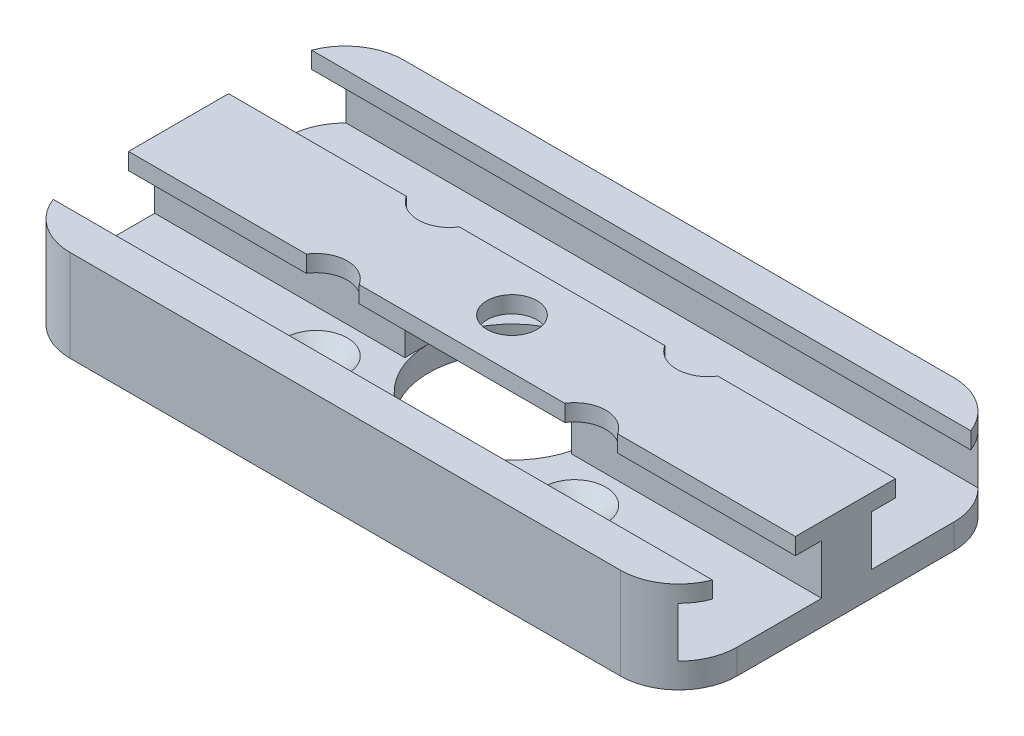
from build123d import *

# Parameters (mm, degrees)
SKETCH1_W                    = 80
SKETCH1_H                    = 40
SKETCH1_R                    = 10
BOSS_EXTRUDE1_DEPTH          = 3
SKETCH2_W                    = 80
SKETCH2_H                    = 4.5
BOSS_EXTRUDE2_DEPTH          = 8
SKETCH3_W                    = 2.5
SKETCH3_H                    = 6
CUT_EXTRUDE1_DEPTH           = 80
SKETCH5_R                    = 1.75
CUT_EXTRUDE3_DEPTH           = 1
SKETCH4_R                    = 3.75
CUT_EXTRUDE4_DEPTH           = 2
CUT_EXTRUDE4_DRAFT           = -45
CUT_EXTRUDE4_PROFILE_2_DEPTH = 2
CUT_EXTRUDE4_PROFILE_2_DRAFT = -45
CUT_EXTRUDE4_PROFILE_3_DEPTH = 2
CUT_EXTRUDE4_PROFILE_3_DRAFT = -45
CUT_EXTRUDE4_PROFILE_4_DEPTH = 2
CUT_EXTRUDE4_PROFILE_4_DRAFT = -45
FILLET1_R                    = 7
SKETCH6_W                    = 30
SKETCH6_H                    = 6
BOSS_EXTRUDE3_DEPTH          = 6
SKETCH7_R                    = 3
BOSS_EXTRUDE4_DEPTH          = 2


with BuildPart() as part:
    # Sketch1 → Boss-Extrude1 (new body)
    with BuildSketch(Plane(origin=(0, 0, 0), x_dir=(1, 0, 0), z_dir=(0, 1, 0))):
        Rectangle(SKETCH1_W, SKETCH1_H)
        with Locations(Location((0, 0, 0), (0, 0, 270))):
            Circle(SKETCH1_R, mode=Mode.SUBTRACT)
    extrude(amount=BOSS_EXTRUDE1_DEPTH)

    # Sketch2 → Boss-Extrude2 (add)
    with BuildSketch(Plane(origin=(0, 3, 0), x_dir=(1, 0, 0), z_dir=(0, 1, 0))):
        with Locations((0, 17.75)):
            Rectangle(SKETCH2_W, SKETCH2_H)
        with Locations((0, -17.75)):
            Rectangle(SKETCH2_W, SKETCH2_H)
    extrude(amount=BOSS_EXTRUDE2_DEPTH)

    # Sketch3 → Cut-Extrude1 (cut)
    with BuildSketch(Plane.ZY.offset(40)):
        with Locations((-16.75, 6)):
            Rectangle(SKETCH3_W, SKETCH3_H)
        with Locations((16.75, 6)):
            Rectangle(SKETCH3_W, SKETCH3_H)
    extrude(amount=-CUT_EXTRUDE1_DEPTH, mode=Mode.SUBTRACT)

    # Sketch5 → Cut-Extrude3 (cut)
    with BuildSketch(Plane.XZ):
        with Locations(Location((-15.5, 8, 0), (0, 0, 270))):
            Circle(SKETCH5_R)
        with Locations(Location((-15.5, -8, 0), (0, 0, 270))):
            Circle(SKETCH5_R)
        with Locations(Location((15.5, 8, 0), (0, 0, 270))):
            Circle(SKETCH5_R)
        with Locations(Location((15.5, -8, 0), (0, 0, 270))):
            Circle(SKETCH5_R)
    extrude(amount=-CUT_EXTRUDE3_DEPTH, mode=Mode.SUBTRACT)


with BuildPart() as cut_extrude4_tool:
    # Sketch4 → Cut-Extrude4 (with draft: the straight prism first)
    with BuildSketch(Plane(origin=(0, 3, 0), x_dir=(1, 0, 0), z_dir=(0, 1, 0))):
        with Locations((-15.5, 8)):
            Circle(SKETCH4_R)
    extrude(amount=-CUT_EXTRUDE4_DEPTH)
    # Cut-Extrude4: the draft: its side faces are tilted about the plane it starts from
    cut_extrude4_sides = [cut_extrude4_tool.faces().sort_by_distance(p)[0] for p in [
        (-19.25, 2, -8),
    ]]
    draft(cut_extrude4_sides, Plane(origin=(0, 3, 0), x_dir=(1, 0, 0), z_dir=(0, 1, 0)), CUT_EXTRUDE4_DRAFT)


with BuildPart() as part_1:
    add(part.part)

    # Cut-Extrude4: cut by cut_extrude4_tool
    add(cut_extrude4_tool.part, mode=Mode.SUBTRACT)


with BuildPart() as cut_extrude4_profile_2_tool:
    # Sketch4 → Cut-Extrude4 profile 2 (with draft: the straight prism first)
    with BuildSketch(Plane(origin=(0, 3, 0), x_dir=(1, 0, 0), z_dir=(0, 1, 0))):
        with Locations((-15.5, -8)):
            Circle(SKETCH4_R)
    extrude(amount=-CUT_EXTRUDE4_PROFILE_2_DEPTH)
    # Cut-Extrude4 profile 2: the draft: its side faces are tilted about the plane it starts from
    cut_extrude4_profile_2_sides = [cut_extrude4_profile_2_tool.faces().sort_by_distance(p)[0] for p in [
        (-19.25, 2, 8),
    ]]
    draft(cut_extrude4_profile_2_sides, Plane(origin=(0, 3, 0), x_dir=(1, 0, 0), z_dir=(0, 1, 0)), CUT_EXTRUDE4_PROFILE_2_DRAFT)


with BuildPart() as part_2:
    add(part_1.part)

    # Cut-Extrude4 profile 2: cut by cut_extrude4_profile_2_tool
    add(cut_extrude4_profile_2_tool.part, mode=Mode.SUBTRACT)


with BuildPart() as cut_extrude4_profile_3_tool:
    # Sketch4 → Cut-Extrude4 profile 3 (with draft: the straight prism first)
    with BuildSketch(Plane(origin=(0, 3, 0), x_dir=(1, 0, 0), z_dir=(0, 1, 0))):
        with Locations((15.5, -8)):
            Circle(SKETCH4_R)
    extrude(amount=-CUT_EXTRUDE4_PROFILE_3_DEPTH)
    # Cut-Extrude4 profile 3: the draft: its side faces are tilted about the plane it starts from
    cut_extrude4_profile_3_sides = [cut_extrude4_profile_3_tool.faces().sort_by_distance(p)[0] for p in [
        (11.75, 2, 8),
    ]]
    draft(cut_extrude4_profile_3_sides, Plane(origin=(0, 3, 0), x_dir=(1, 0, 0), z_dir=(0, 1, 0)), CUT_EXTRUDE4_PROFILE_3_DRAFT)


with BuildPart() as part_3:
    add(part_2.part)

    # Cut-Extrude4 profile 3: cut by cut_extrude4_profile_3_tool
    add(cut_extrude4_profile_3_tool.part, mode=Mode.SUBTRACT)


with BuildPart() as cut_extrude4_profile_4_tool:
    # Sketch4 → Cut-Extrude4 profile 4 (with draft: the straight prism first)
    with BuildSketch(Plane(origin=(0, 3, 0), x_dir=(1, 0, 0), z_dir=(0, 1, 0))):
        with Locations((15.5, 8)):
            Circle(SKETCH4_R)
    extrude(amount=-CUT_EXTRUDE4_PROFILE_4_DEPTH)
    # Cut-Extrude4 profile 4: the draft: its side faces are tilted about the plane it starts from
    cut_extrude4_profile_4_sides = [cut_extrude4_profile_4_tool.faces().sort_by_distance(p)[0] for p in [
        (11.75, 2, -8),
    ]]
    draft(cut_extrude4_profile_4_sides, Plane(origin=(0, 3, 0), x_dir=(1, 0, 0), z_dir=(0, 1, 0)), CUT_EXTRUDE4_PROFILE_4_DRAFT)


with BuildPart() as part_4:
    add(part_3.part)

    # Cut-Extrude4 profile 4: cut by cut_extrude4_profile_4_tool
    add(cut_extrude4_profile_4_tool.part, mode=Mode.SUBTRACT)

    # Fillet1
    fillet1_edges = [part_4.edges().sort_by_distance(p)[0] for p in [
        (40, 5.5, 20),
        (40, 5.5, -20),
        (-40, 5.5, 20),
        (-40, 5.5, -20),
    ]]
    fillet(fillet1_edges, radius=FILLET1_R)

    # Sketch6 → Boss-Extrude3 (add)
    with BuildSketch(Plane(origin=(0, 3, 0), x_dir=(1, 0, 0), z_dir=(0, 1, 0))):
        with Locations((-25, 0.145287111)):
            Rectangle(SKETCH6_W, SKETCH6_H)
        with Locations((25, 0.145287111)):
            Rectangle(SKETCH6_W, SKETCH6_H)
    extrude(amount=BOSS_EXTRUDE3_DEPTH)

    # Sketch7 → Boss-Extrude4 (add)
    with BuildSketch(Plane(origin=(0, 9, 0), x_dir=(1, 0, 0), z_dir=(0, 1, 0))):
        with BuildLine():
            Line((40, 6), (18.672144385, 6))
            ThreePointArc((18.672144385, 6), (15.5, 4.25), (12.327855615, 6))
            Line((12.327855615, 6), (-12.327855615, 6))
            ThreePointArc((-12.327855615, 6), (-15.5, 4.25), (-18.672144385, 6))
            Line((-18.672144385, 6), (-40, 6))
            Line((-40, 6), (-40, -6))
            Line((-40, -6), (-18.672144385, -6))
            ThreePointArc((-18.672144385, -6), (-15.5, -4.25), (-12.327855615, -6))
            Line((-12.327855615, -6), (12.327855615, -6))
            ThreePointArc((12.327855615, -6), (15.5, -4.25), (18.672144385, -6))
            Line((18.672144385, -6), (40, -6))
            Line((40, -6), (40, 6))
        make_face()
        with Locations(Location((0, 0, 0), (0, 0, 270))):
            Circle(SKETCH7_R, mode=Mode.SUBTRACT)
    extrude(amount=BOSS_EXTRUDE4_DEPTH)


solid = part_4.part
